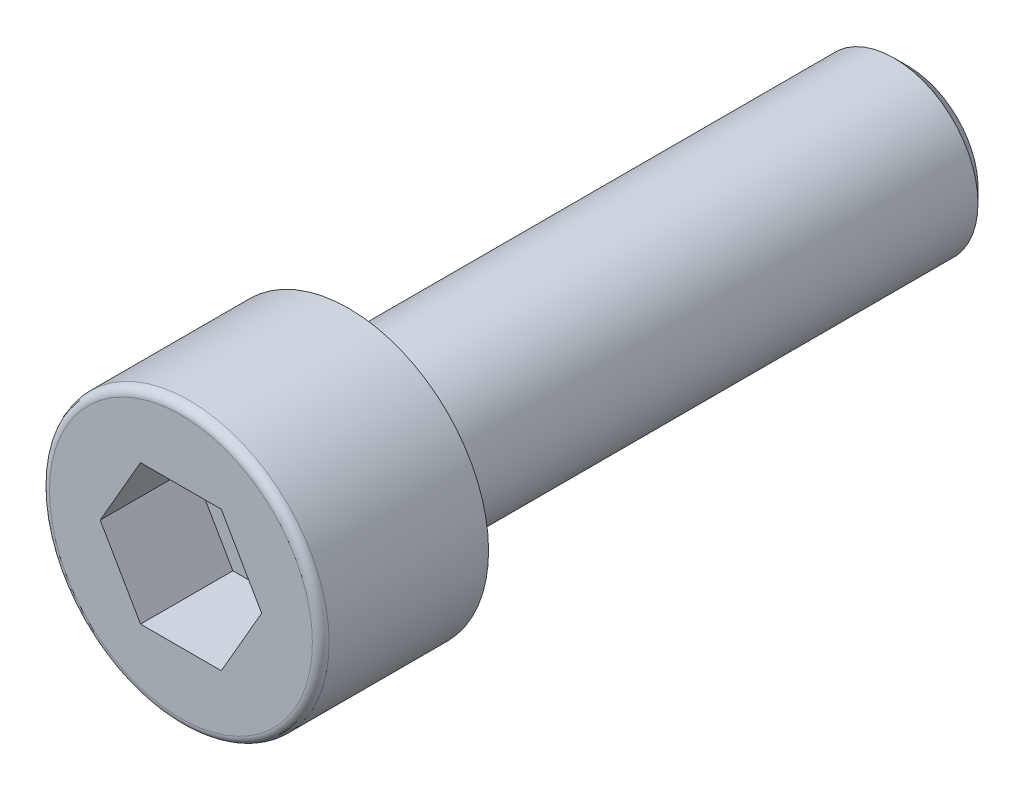
from build123d import *

# Parameters (mm, degrees)
CUT_EXTRUDE1_DEPTH = 3.3
CHAMFER1_SIZE      = 0.5


with BuildPart() as part:
    # Sketch1 → Revolve1 (revolve)
    with BuildSketch(Plane.XZ, mode=Mode.PRIVATE) as revolve1_sk:
        with BuildLine():
            Line((0, -20), (-3, -20))
            Line((-3, -20), (-3, 0))
            Line((-3, 0), (-5, 0))
            Line((-5, 0), (-5, 5.7))
            ThreePointArc((-5, 5.7), (-4.912132034, 5.912132034), (-4.7, 6))
            Line((-4.7, 6), (0, 6))
            Line((0, 6), (0, -20))
        make_face()
    revolve(revolve1_sk.sketch.rotate(Axis((0, 0, 6), (0, 0, -1)), 180), axis=Axis((0, 0, 6), (0, 0, -1)))

    # Sketch2 → Cut-Extrude1 (cut)
    with BuildSketch(Plane.XY.offset(6)):
        Polygon((2.886751346, 0), (1.443375673, 2.5), (-1.443375673, 2.5), (-2.886751346, 0), (-1.443375673, -2.5), (1.443375673, -2.5), align=None)
    extrude(amount=-CUT_EXTRUDE1_DEPTH, mode=Mode.SUBTRACT)

    # Chamfer1
    chamfer1_edges = [part.edges().sort_by_distance(p)[0] for p in [
        (-3, 0, -20),
    ]]
    chamfer(chamfer1_edges, length=CHAMFER1_SIZE)


solid = part.part
